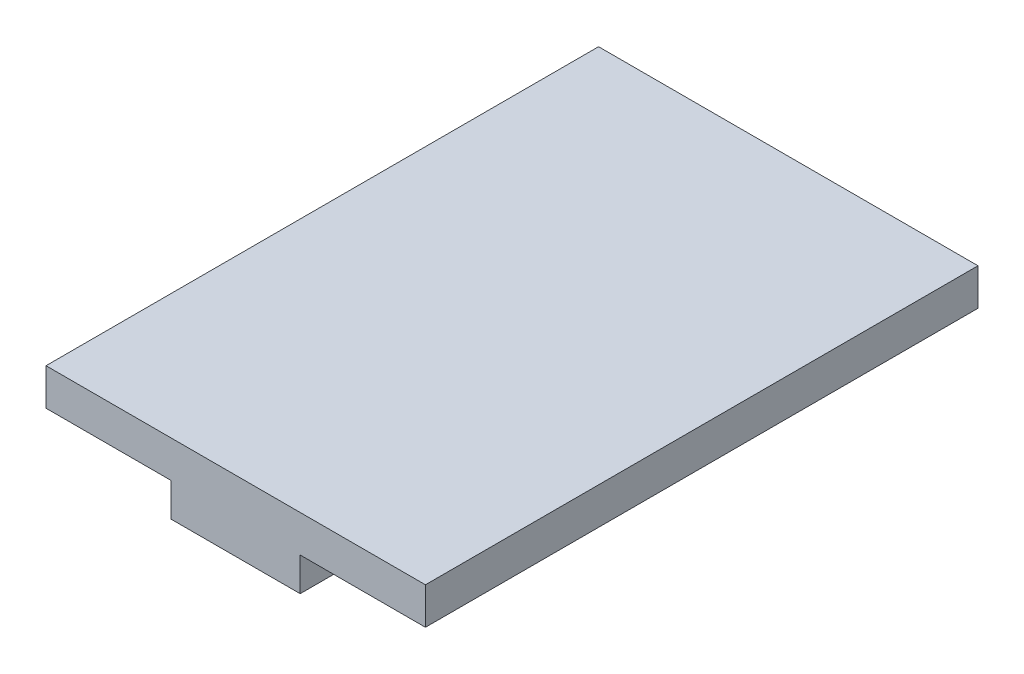
from build123d import *

# Parameters (mm, degrees)
SKETCH1_W           = 20.6
SKETCH1_H           = 2
BOSS_EXTRUDE1_DEPTH = 30
SKETCH2_W           = 7
SKETCH2_H           = 1.82
BOSS_EXTRUDE2_DEPTH = 10


with BuildPart() as part:
    # Sketch1 → Boss-Extrude1 (new body)
    with BuildSketch(Plane.XY):
        with Locations((0, 1)):
            Rectangle(SKETCH1_W, SKETCH1_H)
    extrude(amount=-BOSS_EXTRUDE1_DEPTH)

    # Sketch2 → Boss-Extrude2 (add)
    with BuildSketch(Plane.XY):
        with Locations((0, -0.91)):
            Rectangle(SKETCH2_W, SKETCH2_H)
    extrude(amount=-BOSS_EXTRUDE2_DEPTH)


solid = part.part
